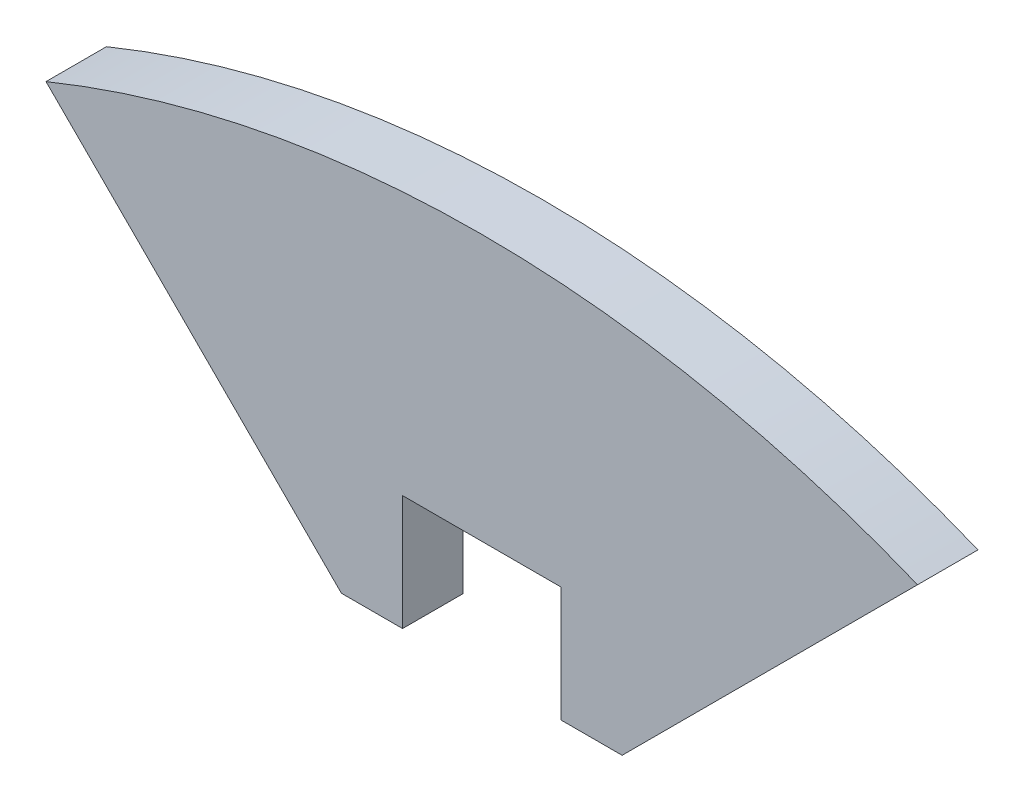
from build123d import *

# Parameters (mm, degrees)
EXTRUDE_1_DEPTH = 2.1


with BuildPart() as part:
    # Эскиз1 → Бобышка-Вытянуть1 (new body)
    with BuildSketch(Plane.XY):
        with BuildLine():
            Line((0, 0), (2.125, 0))
            Line((2.125, 0), (2.125, 4))
            Line((2.125, 4), (7.625, 4))
            Line((7.625, 4), (7.625, 0))
            Line((7.625, 0), (9.75, 0))
            Line((9.75, 0), (20.010119395, 10.260119395))
            ThreePointArc((20.010119395, 10.260119395), (4.875, 13.234072335), (-10.260119395, 10.260119395))
            Line((-10.260119395, 10.260119395), (0, 0))
        make_face()
    extrude(amount=EXTRUDE_1_DEPTH)


solid = part.part
